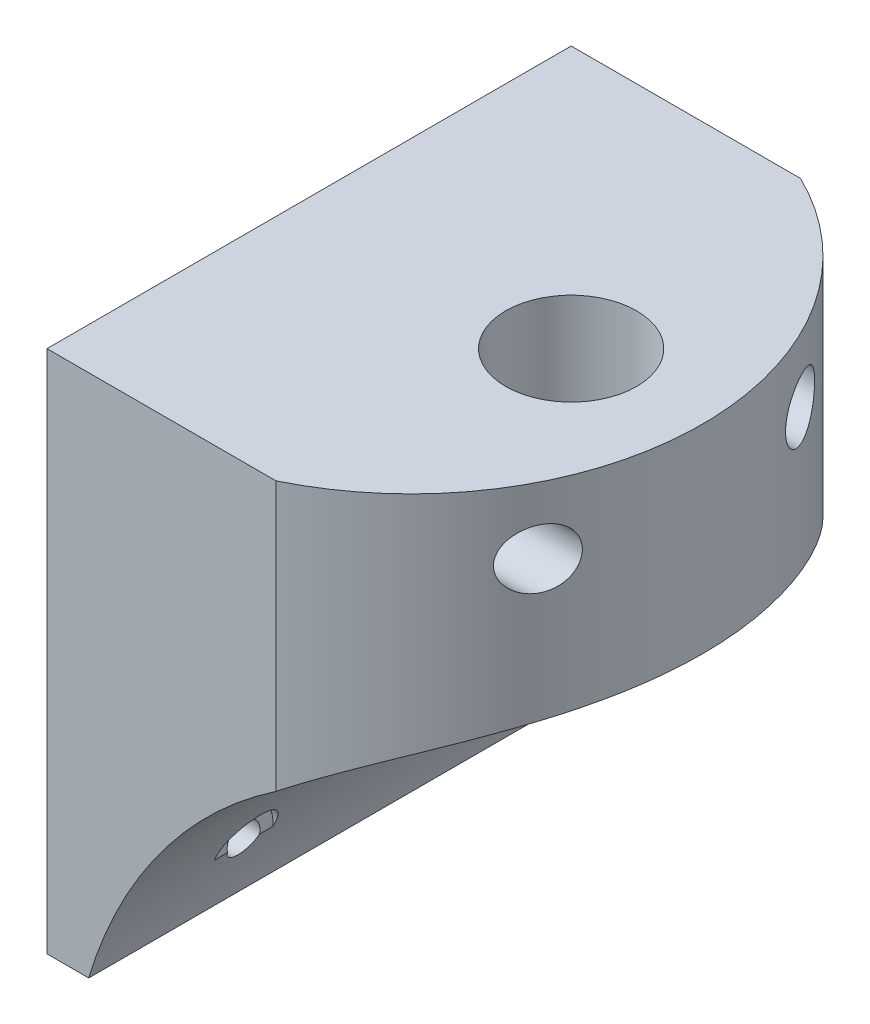
from build123d import *

# Parameters (mm, degrees)
SKETCH2_R           = 10
BOSS_EXTRUDE1_DEPTH = 40
CUT_EXTRUDE1_DEPTH  = 40
SKETCH4_R           = 2.5
CUT_EXTRUDE2_DEPTH  = 80
SKETCH5_R           = 4.5
CUT_EXTRUDE3_DEPTH  = 80


with BuildPart() as part:
    # Sketch2 → Boss-Extrude1 (new, symmetric)
    with BuildSketch(Plane(origin=(0, 0, 0), x_dir=(1, 0, 0), z_dir=(0, 1, 0))):
        with BuildLine():
            Line((0, 40), (0, -40))
            Line((0, -40), (34.939220954, -40))
            ThreePointArc((34.939220954, -40), (60, -0.01901654), (35, 40))
            Line((35, 40), (0, 40))
        make_face()
        with Locations(Location((40, 0, 0), (0, 0, 270))):
            Circle(SKETCH2_R, mode=Mode.SUBTRACT)
    extrude(amount=BOSS_EXTRUDE1_DEPTH, both=True)

    # Sketch3 → Cut-Extrude1 (cut, symmetric)
    with BuildSketch(Plane.XY):
        with BuildLine():
            Line((60.000012836, 9.630791914), (60.000012836, -40))
            Line((60.000012836, -40), (6.370793002, -40))
            ThreePointArc((6.370793002, -40), (26.384718506, -7.836033018), (60.000012836, 9.630791914))
        make_face()
    extrude(amount=CUT_EXTRUDE1_DEPTH, both=True, mode=Mode.SUBTRACT)

    # Sketch4 → Cut-Extrude2 (cut)
    with BuildSketch(Plane(origin=(0, 0, 0), x_dir=(0, 0, -1), z_dir=(1, 0, 0))):
        with Locations(Location((-20, 29.846630116, 0), (0, 0, 180))):
            Circle(SKETCH4_R)
        with Locations(Location((20, 29.846630116, 0), (0, 0, 180))):
            Circle(SKETCH4_R)
        with Locations(Location((20, -29.846630116, 0), (0, 0, 180))):
            Circle(SKETCH4_R)
        with Locations(Location((-20, -29.846630116, 0), (0, 0, 180))):
            Circle(SKETCH4_R)
    extrude(amount=CUT_EXTRUDE2_DEPTH, mode=Mode.SUBTRACT)

    # Sketch5 → Cut-Extrude3 (cut)
    with BuildSketch(Plane(origin=(10, 0, 0), x_dir=(0, 0, -1), z_dir=(1, 0, 0))):
        with Locations(Location((20, 29.846630116, 0), (0, 0, 180))):
            Circle(SKETCH5_R)
        with Locations(Location((-20, 29.846630116, 0), (0, 0, 180))):
            Circle(SKETCH5_R)
        with Locations((20, -29.846630116)):
            Circle(SKETCH5_R)
        with Locations((-20, -29.846630116)):
            Circle(SKETCH5_R)
    extrude(amount=CUT_EXTRUDE3_DEPTH, mode=Mode.SUBTRACT)


solid = part.part
